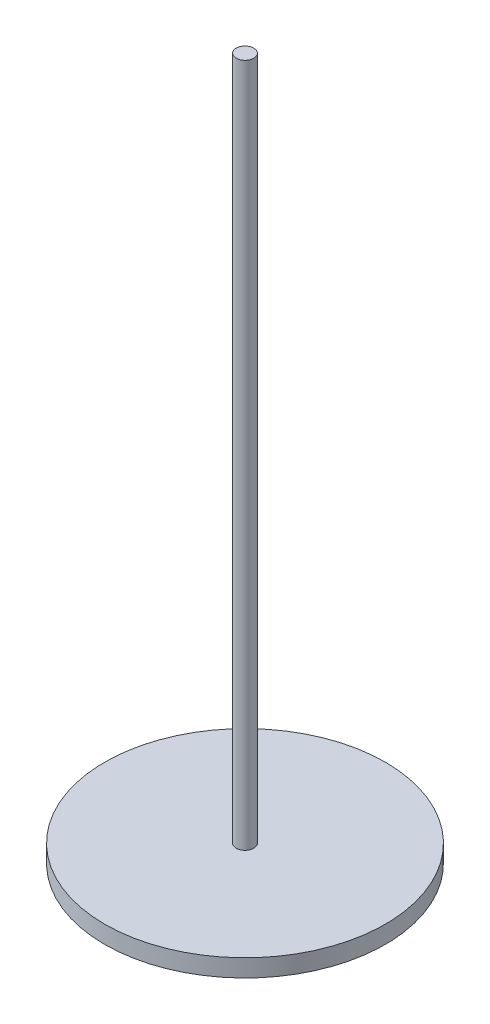
from build123d import *


with BuildPart() as part:
    # Sketch1 → Revolve1 (revolve)
    with BuildSketch(Plane(origin=(0, 0, 0), x_dir=(0, 0, -1), z_dir=(1, 0, 0))):
        Polygon((-1.25, 76.584507042), (-1.25, -20.915492958), (-20, -20.915492958), (-20, -23.415492958), (0, -23.415492958), (0, 76.584507042), align=None)
    revolve(axis=Axis((0, 76.584507042, 0), (0, -1, 0)))


solid = part.part
